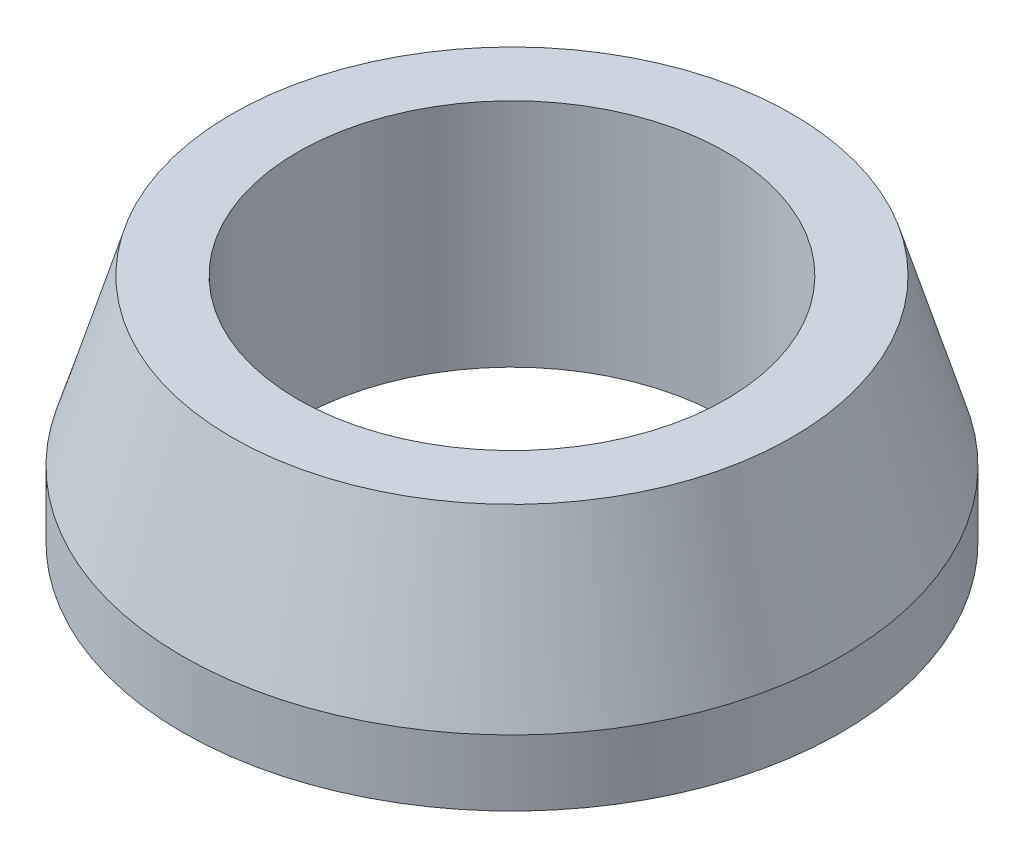
from build123d import *

# Parameters (mm, degrees)
SKETCH2_R           = 10
SKETCH2_R_2         = 6.5
BOSS_EXTRUDE1_DEPTH = 2
SKETCH1_R           = 8.5
SKETCH4_R           = 6.5
CUT_EXTRUDE1_DEPTH  = 16.000000167


with BuildPart() as part:
    # Sketch2 → Boss-Extrude1 (new body)
    with BuildSketch(Plane(origin=(0, -5, 0), x_dir=(1, 0, 0), z_dir=(0, 1, 0))):
        with Locations(Location((0, 0, 0), (0, 0, 270))):
            Circle(SKETCH2_R)
        with Locations(Location((0, 0, 0), (0, 0, 270))):
            Circle(SKETCH2_R_2, mode=Mode.SUBTRACT)
    extrude(amount=-BOSS_EXTRUDE1_DEPTH)

    # Sketch1 → section 1 of loft6
    with BuildSketch(Plane(origin=(0, 0, 0), x_dir=(1, 0, 0), z_dir=(0, 1, 0)), mode=Mode.PRIVATE) as loft6_s1:
        Circle(SKETCH1_R)
    # loft up to a face of the part (loft6)
    loft([Face(Wire([part.edges().sort_by_distance((7.289686274, -5, -6.845471059))[0]])), loft6_s1.sketch])

    # Sketch4 → Cut-Extrude1 (cut, through all)
    with BuildSketch(Plane.XZ.offset(5)):
        with Locations(Location((0, 0, 0), (0, 0, 90))):
            Circle(SKETCH4_R)
    extrude(amount=-CUT_EXTRUDE1_DEPTH, mode=Mode.SUBTRACT)


solid = part.part
